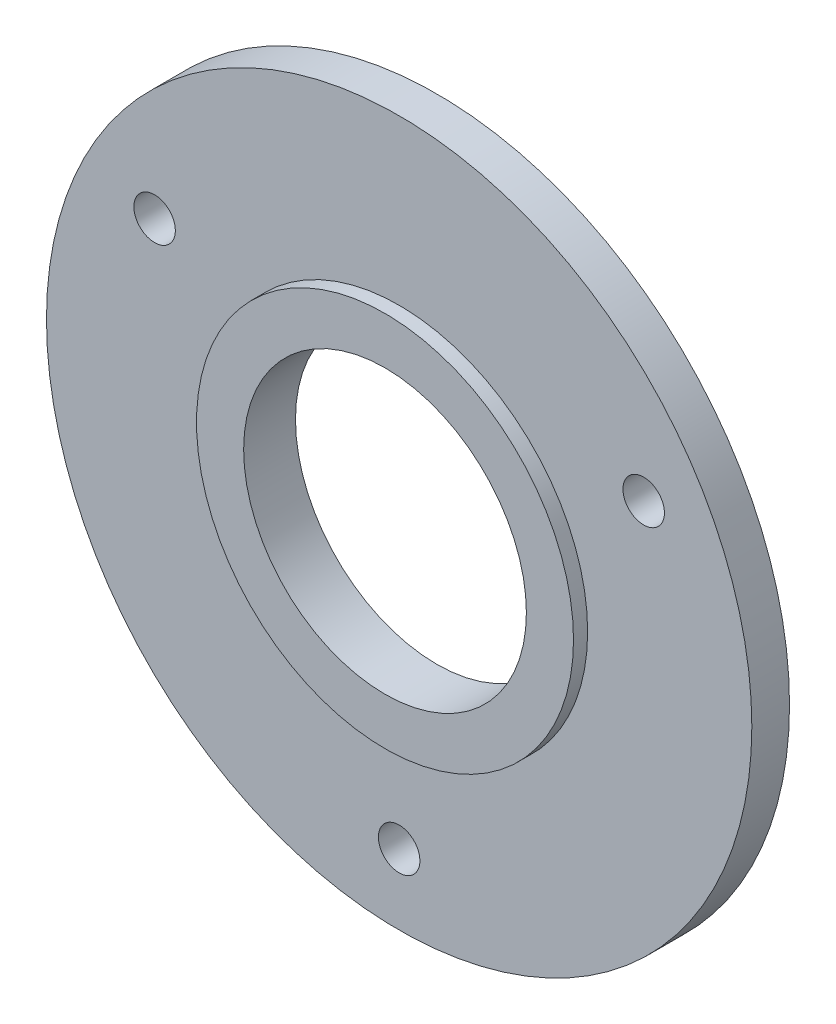
from build123d import *

# Parameters (mm, degrees)
SKETCH1_R           = 18.71
SKETCH1_R_2         = 1.1
SKETCH1_R_3         = 7.5
BOSS_EXTRUDE1_DEPTH = 2
SKETCH2_R           = 10
SKETCH2_R_2         = 7.5
BOSS_EXTRUDE2_DEPTH = 0.75


with BuildPart() as part:
    # Sketch1 → Boss-Extrude1 (new body)
    with BuildSketch(Plane.XY):
        Circle(SKETCH1_R)
        with Locations((0, -14.98)):
            Circle(SKETCH1_R_2, mode=Mode.SUBTRACT)
        with Locations((-12.973060549, 7.49)):
            Circle(SKETCH1_R_2, mode=Mode.SUBTRACT)
        with Locations((12.973060549, 7.49)):
            Circle(SKETCH1_R_2, mode=Mode.SUBTRACT)
        Circle(SKETCH1_R_3, mode=Mode.SUBTRACT)
    extrude(amount=BOSS_EXTRUDE1_DEPTH)

    # Sketch2 → Boss-Extrude2 (add)
    with BuildSketch(Plane.XY.offset(2)):
        Circle(SKETCH2_R)
        Circle(SKETCH2_R_2, mode=Mode.SUBTRACT)
    extrude(amount=BOSS_EXTRUDE2_DEPTH)


solid = part.part
